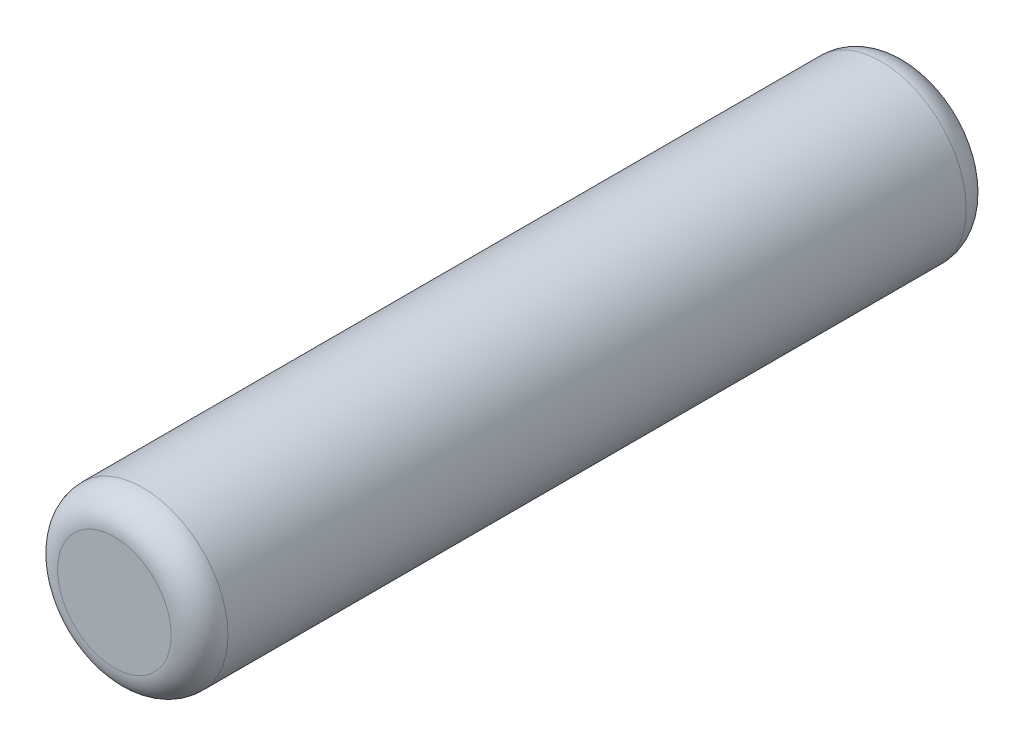
from build123d import *

# Parameters (mm, degrees)
SZKIC1_R                    = 3
DODANIE_WYCI_GNI_CIE1_DEPTH = 28
ZAOKR_GLENIE1_R             = 1


with BuildPart() as part:
    # Szkic1 → Dodanie-wyciągnięcie1 (new body)
    with BuildSketch(Plane.XY):
        Circle(SZKIC1_R)
    extrude(amount=DODANIE_WYCI_GNI_CIE1_DEPTH)

    # Zaokrąglenie1
    zaokr_glenie1_edges = [part.edges().sort_by_distance(p)[0] for p in [
        (-3, 0, 0),
        (-3, 0, 28),
    ]]
    fillet(zaokr_glenie1_edges, radius=ZAOKR_GLENIE1_R)


solid = part.part
